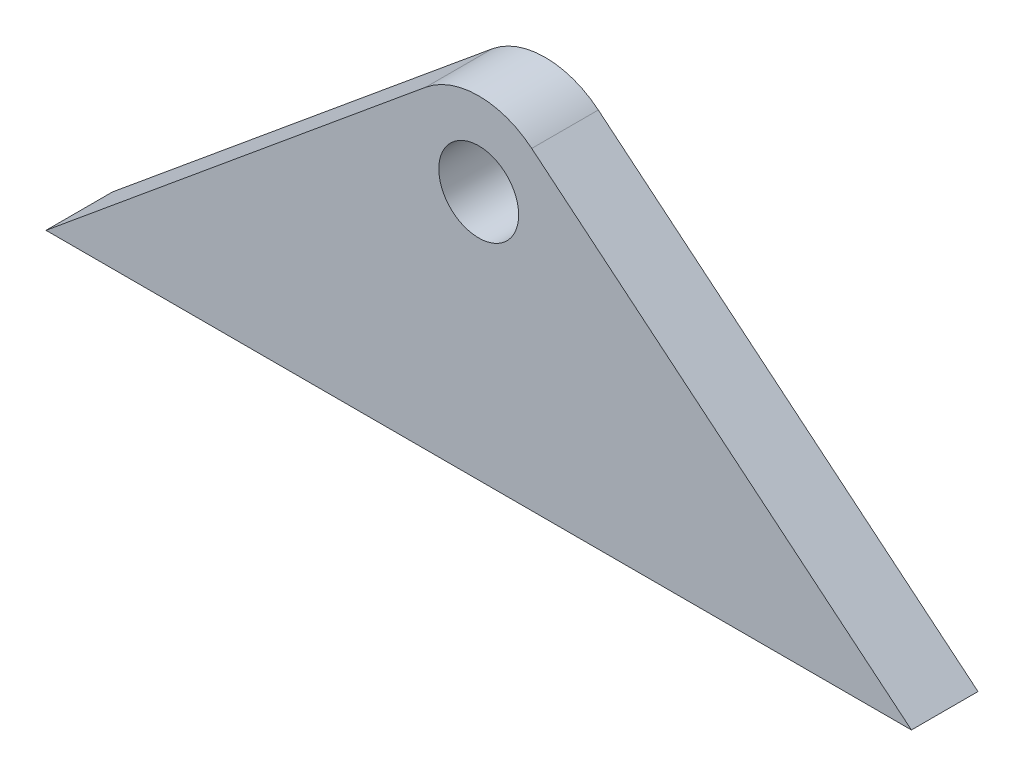
from build123d import *

# Parameters (mm, degrees)
SKETCH1_R           = 12
BOSS_EXTRUDE1_DEPTH = 10


with BuildPart() as part:
    # Sketch1 → Boss-Extrude1 (new, symmetric)
    with BuildSketch(Plane.XY):
        with BuildLine():
            Line((130, 0), (-130, 0))
            Line((-130, 0), (-15.92562313, 94.271080092))
            ThreePointArc((-15.92562313, 94.271080092), (0, 100), (15.92562313, 94.271080092))
            Line((15.92562313, 94.271080092), (130, 0))
        make_face()
        with Locations((0, 75)):
            Circle(SKETCH1_R, mode=Mode.SUBTRACT)
    extrude(amount=BOSS_EXTRUDE1_DEPTH, both=True)


solid = part.part
